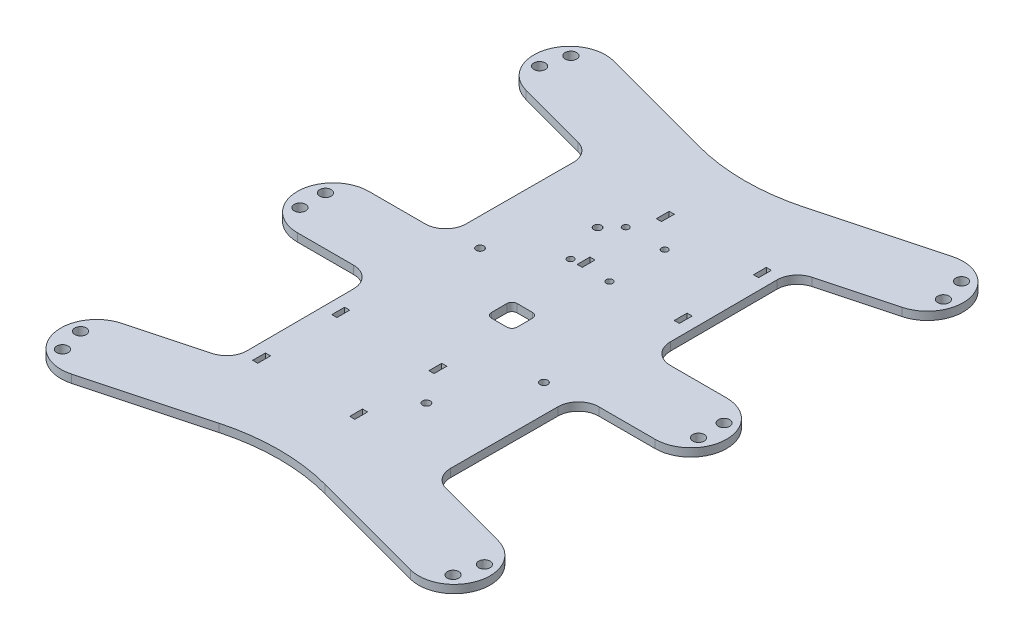
from build123d import *

# Parameters (mm, degrees)
BOSS_EXTRUDE1_DEPTH = 3.175
FILLET1_R           = 80
FILLET2_R           = 8
SKETCH7_R           = 2.25
CUT_EXTRUDE4_DEPTH  = 10
CUT_EXTRUDE5_DEPTH  = 10
SKETCH9_W           = 10
SKETCH9_H           = 10
CUT_EXTRUDE6_DEPTH  = 10
FILLET3_R           = 2
SKETCH12_W          = 2
SKETCH12_H          = 5
CUT_EXTRUDE7_DEPTH  = 10
SKETCH13_R          = 1.25
CUT_EXTRUDE8_DEPTH  = 10


with BuildPart() as part:
    # Sketch1 → Boss-Extrude1 (new body)
    with BuildSketch(Plane(origin=(0, 0, 0), x_dir=(1, 0, 0), z_dir=(0, 1, 0))):
        with BuildLine():
            Line((-70, 14), (-40, 14))
            Line((-40, 14), (-39.816062711, 70))
            Line((-39.816062711, 70), (-73.623466631, 79.058666579))
            ThreePointArc((-73.623466631, 79.058666579), (-83.522961568, 96.205094778), (-66.376533369, 106.104589715))
            Line((-66.376533369, 106.104589715), (0, 88.319051202))
            Line((0, 88.319051202), (66.376533369, 106.104589715))
            ThreePointArc((66.376533369, 106.104589715), (83.522961568, 96.205094778), (73.623466631, 79.058666579))
            Line((73.623466631, 79.058666579), (39.816062711, 70))
            Line((39.816062711, 70), (40, 14))
            Line((40, 14), (70, 14))
            ThreePointArc((70, 14), (84, 0), (70, -14))
            Line((70, -14), (40, -14))
            Line((40, -14), (39.816062711, -70))
            Line((39.816062711, -70), (73.623466631, -79.058666579))
            ThreePointArc((73.623466631, -79.058666579), (83.522961568, -96.205094778), (66.376533369, -106.104589715))
            Line((66.376533369, -106.104589715), (0, -88.319051202))
            Line((0, -88.319051202), (-66.376533369, -106.104589715))
            ThreePointArc((-66.376533369, -106.104589715), (-83.522961568, -96.205094778), (-73.623466631, -79.058666579))
            Line((-73.623466631, -79.058666579), (-39.816062711, -70))
            Line((-39.816062711, -70), (-40, -14))
            Line((-40, -14), (-70, -14))
            ThreePointArc((-70, -14), (-84, 0), (-70, 14))
        make_face()
    extrude(amount=BOSS_EXTRUDE1_DEPTH)

    # Fillet1
    fillet1_edges = [part.edges().sort_by_distance(p)[0] for p in [
        (0, 1.5875, -88.319051202),
        (0, 1.5875, 88.319051202),
    ]]
    fillet(fillet1_edges, radius=FILLET1_R)

    # Fillet2
    fillet2_edges = [part.edges().sort_by_distance(p)[0] for p in [
        (-40, 1.5875, -14),
        (-39.816062711, 1.5875, -70),
        (39.816062711, 1.5875, -70),
        (40, 1.5875, -14),
        (40, 1.5875, 14),
        (39.816062711, 1.5875, 70),
        (-39.816062711, 1.5875, 70),
        (-40, 1.5875, 14),
    ]]
    fillet(fillet2_edges, radius=FILLET2_R)

    # Sketch7 → Cut-Extrude4 (cut)
    with BuildSketch(Plane(origin=(0, 3.175, 0), x_dir=(1, 0, 0), z_dir=(0, 1, 0))):
        with Locations(Location((-76.433311385, -99.481809639, 0), (0, 0, 270))):
            Circle(SKETCH7_R)
        with Locations(Location((-79.021501836, -89.822551376, 0), (0, 0, 270))):
            Circle(SKETCH7_R)
        with Locations(Location((-78, -5, 0), (0, 0, 270))):
            Circle(SKETCH7_R)
        with Locations(Location((-78, 5, 0), (0, 0, 270))):
            Circle(SKETCH7_R)
        with Locations(Location((-79.021501836, 89.822551376, 0), (0, 0, 270))):
            Circle(SKETCH7_R)
        with Locations(Location((-76.433311385, 99.481809639, 0), (0, 0, 270))):
            Circle(SKETCH7_R)
        with Locations(Location((79.021501836, 89.822551376, 0), (0, 0, 270))):
            Circle(SKETCH7_R)
        with Locations(Location((76.433311385, 99.481809639, 0), (0, 0, 270))):
            Circle(SKETCH7_R)
        with Locations(Location((78, -5, 0), (0, 0, 270))):
            Circle(SKETCH7_R)
        with Locations(Location((78, 5, 0), (0, 0, 270))):
            Circle(SKETCH7_R)
        with Locations(Location((79.021501836, -89.822551376, 0), (0, 0, 270))):
            Circle(SKETCH7_R)
        with Locations(Location((76.433311385, -99.481809639, 0), (0, 0, 270))):
            Circle(SKETCH7_R)
    extrude(amount=-CUT_EXTRUDE4_DEPTH, mode=Mode.SUBTRACT)

    # Sketch8 → Cut-Extrude5 (cut)
    with BuildSketch(Plane(origin=(0, 3.175, 0), x_dir=(1, 0, 0), z_dir=(0, 1, 0))):
        with BuildLine():
            ThreePointArc((13, -45), (11.5, -46.5), (13, -48))
            ThreePointArc((13, -48), (14.5, -46.5), (13, -45))
        make_face()
        with BuildLine():
            ThreePointArc((29, -15), (27.5, -16.5), (29, -18))
            ThreePointArc((29, -18), (30.5, -16.5), (29, -15))
        make_face()
        with BuildLine():
            ThreePointArc((-13, 48), (-14.5, 46.5), (-13, 45))
            ThreePointArc((-13, 45), (-11.5, 46.5), (-13, 48))
        make_face()
        with BuildLine():
            ThreePointArc((-29, 18), (-30.5, 16.5), (-29, 15))
            ThreePointArc((-29, 15), (-27.5, 16.5), (-29, 18))
        make_face()
    extrude(amount=-CUT_EXTRUDE5_DEPTH, mode=Mode.SUBTRACT)

    # Sketch9 → Cut-Extrude6 (cut)
    with BuildSketch(Plane(origin=(0, 3.175, 0), x_dir=(1, 0, 0), z_dir=(0, 1, 0))):
        Rectangle(SKETCH9_W, SKETCH9_H)
    extrude(amount=-CUT_EXTRUDE6_DEPTH, mode=Mode.SUBTRACT)

    # Fillet3
    fillet3_edges = [part.edges().sort_by_distance(p)[0] for p in [
        (-5, 1.5875, 5),
        (-5, 1.5875, -5),
        (5, 1.5875, -5),
        (5, 1.5875, 5),
    ]]
    fillet(fillet3_edges, radius=FILLET3_R)

    # Sketch12 → Cut-Extrude7 (cut)
    with BuildSketch(Plane(origin=(0, 3.175, 0), x_dir=(1, 0, 0), z_dir=(0, 1, 0))):
        with Locations((-34.5, -32.5)):
            Rectangle(SKETCH12_W, SKETCH12_H)
        with Locations((-34.5, -63.5)):
            Rectangle(SKETCH12_W, SKETCH12_H)
        with Locations((3.5, -63.5)):
            Rectangle(SKETCH12_W, SKETCH12_H)
        with Locations((3.5, -32.5)):
            Rectangle(SKETCH12_W, SKETCH12_H)
        with Locations((-3.5, 63.5)):
            Rectangle(SKETCH12_W, SKETCH12_H)
        with Locations((-3.5, 32.5)):
            Rectangle(SKETCH12_W, SKETCH12_H)
        with Locations((34.5, 32.5)):
            Rectangle(SKETCH12_W, SKETCH12_H)
        with Locations((34.5, 63.5)):
            Rectangle(SKETCH12_W, SKETCH12_H)
    extrude(amount=-CUT_EXTRUDE7_DEPTH, mode=Mode.SUBTRACT)

    # Sketch13 → Cut-Extrude8 (cut)
    with BuildSketch(Plane(origin=(0, 3.175, 0), x_dir=(1, 0, 0), z_dir=(0, 1, 0))):
        with Locations(Location((-7.62, 30.54, 0), (0, 0, 270))):
            Circle(SKETCH13_R)
        with Locations(Location((-7.62, 52.13, 0), (0, 0, 270))):
            Circle(SKETCH13_R)
        with Locations(Location((7.62, 52.13, 0), (0, 0, 270))):
            Circle(SKETCH13_R)
        with Locations(Location((7.62, 30.54, 0), (0, 0, 270))):
            Circle(SKETCH13_R)
    extrude(amount=-CUT_EXTRUDE8_DEPTH, mode=Mode.SUBTRACT)


solid = part.part
